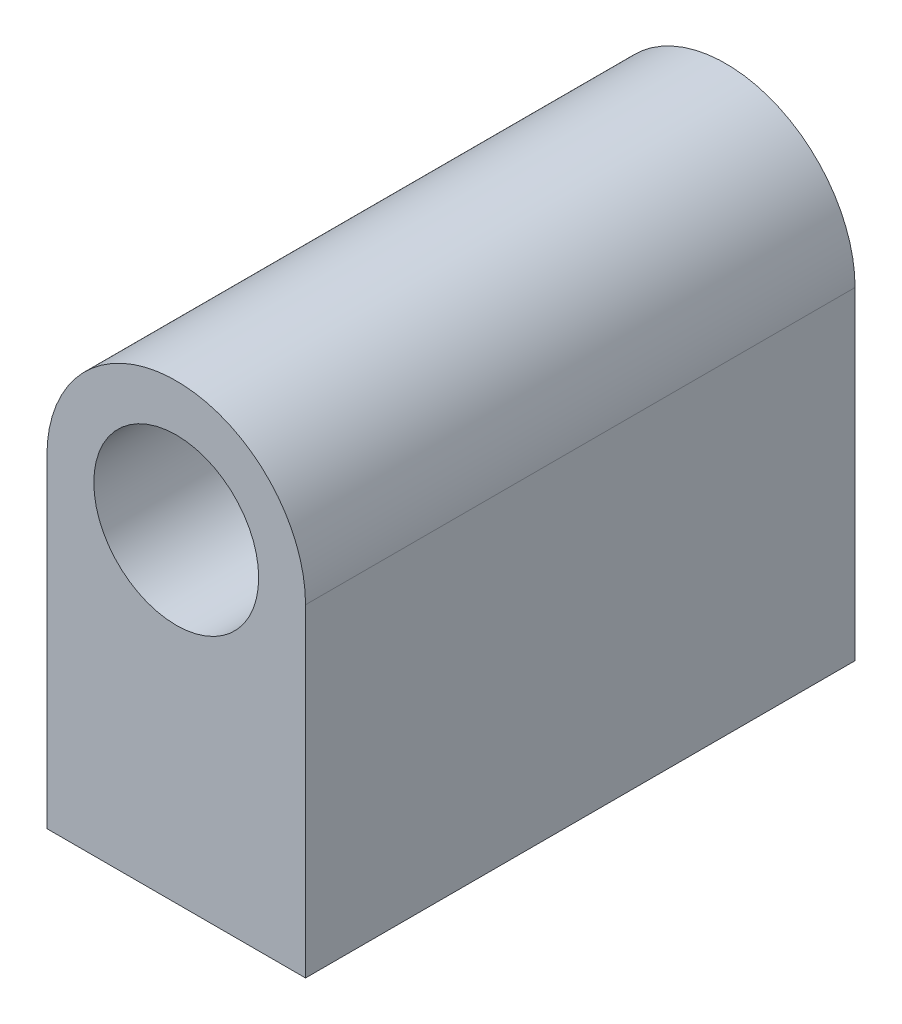
from build123d import *

# Parameters (mm, degrees)
SKETCH1_R           = 4
SKETCH1_R_2         = 2.3
BOSS_EXTRUDE1_DEPTH = 6
SKETCH2_R           = 4
SKETCH2_R_2         = 2.55
BOSS_EXTRUDE2_DEPTH = 11
SKETCH3_R           = 2.55
BOSS_EXTRUDE3_DEPTH = 17


with BuildPart() as part:
    # Sketch1 → Boss-Extrude1 (new body)
    with BuildSketch(Plane.XY):
        Circle(SKETCH1_R)
        Circle(SKETCH1_R_2, mode=Mode.SUBTRACT)
    extrude(amount=BOSS_EXTRUDE1_DEPTH)

    # Sketch2 → Boss-Extrude2 (add)
    with BuildSketch(Plane.XY.offset(6)):
        Circle(SKETCH2_R)
        Circle(SKETCH2_R_2, mode=Mode.SUBTRACT)
    extrude(amount=BOSS_EXTRUDE2_DEPTH)

    # Sketch3 → Boss-Extrude3 (add)
    with BuildSketch(Plane(origin=(0, 0, 0), x_dir=(-1, 0, 0), z_dir=(0, 0, -1))):
        with BuildLine():
            Line((-4, 0), (-4, -10))
            Line((-4, -10), (4, -10))
            Line((4, -10), (4, 0))
            ThreePointArc((4, 0), (0, 4), (-4, 0))
        make_face()
        with Locations(Location((0, 0, 0), (0, 0, 180))):
            Circle(SKETCH3_R, mode=Mode.SUBTRACT)
    extrude(amount=-BOSS_EXTRUDE3_DEPTH)


solid = part.part
